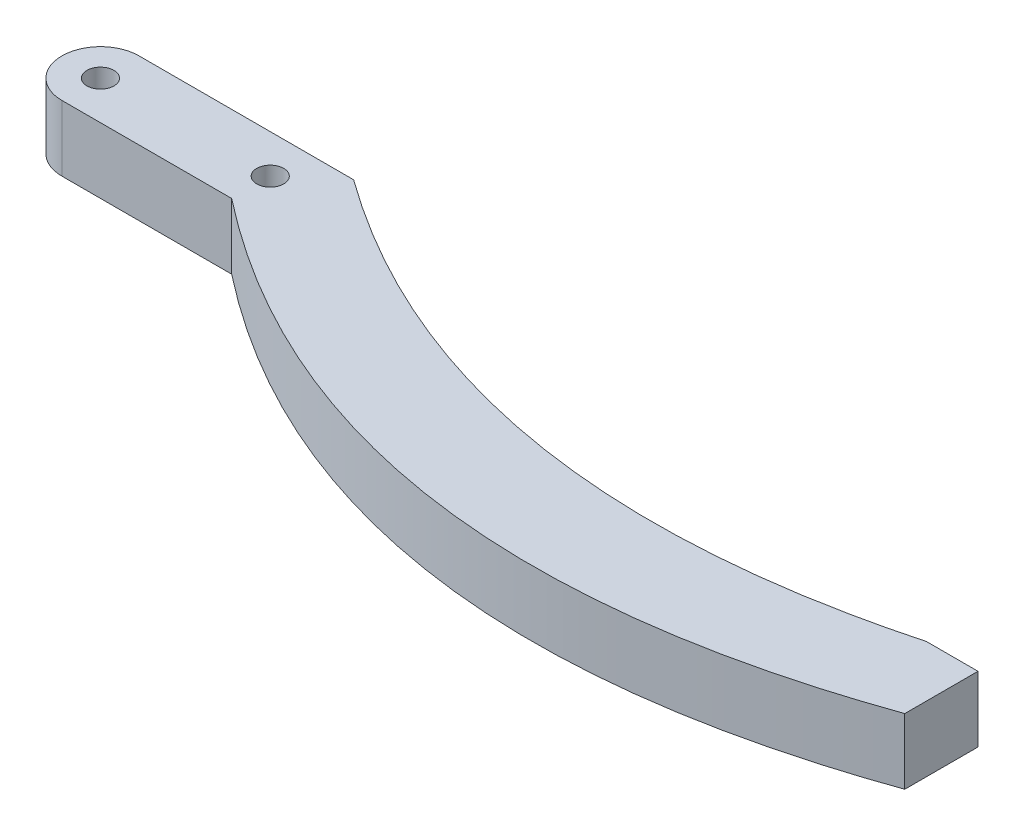
from build123d import *

# Parameters (mm, degrees)
CROQUIS2_R              = 1.75
SALIENTE_EXTRUIR1_DEPTH = 8.5


with BuildPart() as part:
    # Croquis2 → Saliente-Extruir1 (new body)
    with BuildSketch(Plane(origin=(0, 0, 0), x_dir=(1, 0, 0), z_dir=(0, 1, 0))):
        with BuildLine():
            Line((-22, -5), (0, -5))
            add(Edge.make_bspline(
                [(0, -5), (44.060717463, -39.575226666), (101.432631882, -19.199942723)],
                knots=[0, 0, 0, 1, 1, 1], degree=2))
            Line((101.432631882, -19.199942723), (101.432631882, -9.706723131))
            Line((101.432631882, -9.706723131), (94.748347294, -9.706723131))
            add(Edge.make_bspline(
                [(5.809010248, 5), (44.703591594, -23.148227448), (94.748347294, -9.706723131)],
                knots=[0, 0, 0, 1, 1, 1], degree=2))
            Line((5.809010248, 5), (0, 5))
            Line((0, 5), (-0.763110027, 5))
            Line((-0.763110027, 5), (-22, 5))
            ThreePointArc((-22, 5), (-27, 0), (-22, -5))
        make_face()
        with Locations(Location((-22, 0, 0), (0, 0, 270))):
            Circle(CROQUIS2_R, mode=Mode.SUBTRACT)
        with Locations(Location((0, 0, 0), (0, 0, 270))):
            Circle(CROQUIS2_R, mode=Mode.SUBTRACT)
    extrude(amount=SALIENTE_EXTRUIR1_DEPTH)


solid = part.part
